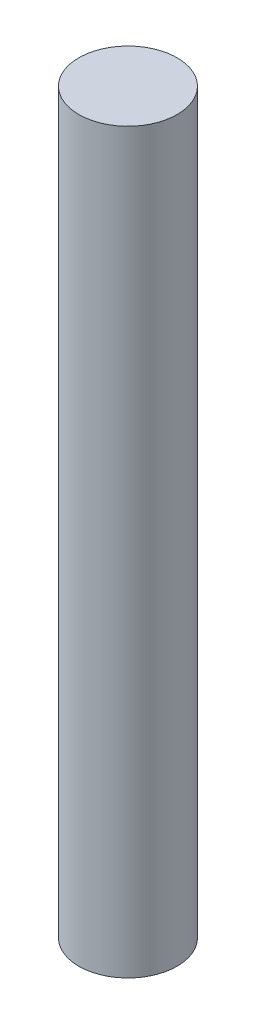
from build123d import *

# Parameters (mm, degrees)
SKETCH2_R           = 8
BOSS_EXTRUDE1_DEPTH = 60


with BuildPart() as part:
    # Sketch2 → Boss-Extrude1 (new, symmetric)
    with BuildSketch(Plane(origin=(0, 0, 0), x_dir=(1, 0, 0), z_dir=(0, 1, 0))):
        with Locations(Location((0, 0, 0), (0, 0, 270))):
            Circle(SKETCH2_R)
    extrude(amount=BOSS_EXTRUDE1_DEPTH, both=True)


solid = part.part
